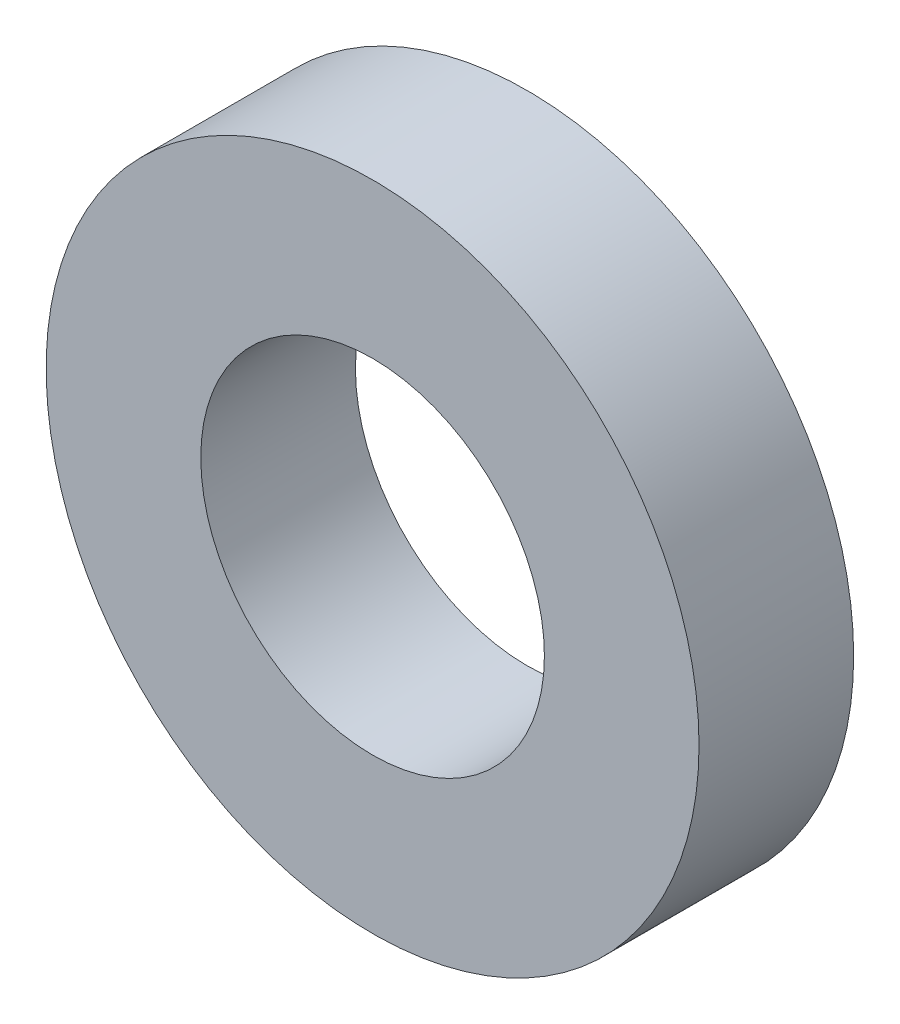
from build123d import *

# Parameters (mm, degrees)
SKETCH1_R           = 9.5
SKETCH1_R_2         = 5
BOSS_EXTRUDE1_DEPTH = 2.25


with BuildPart() as part:
    # Sketch1 → Boss-Extrude1 (new, symmetric)
    with BuildSketch(Plane.XY):
        Circle(SKETCH1_R)
        Circle(SKETCH1_R_2, mode=Mode.SUBTRACT)
    extrude(amount=BOSS_EXTRUDE1_DEPTH, both=True)


solid = part.part
